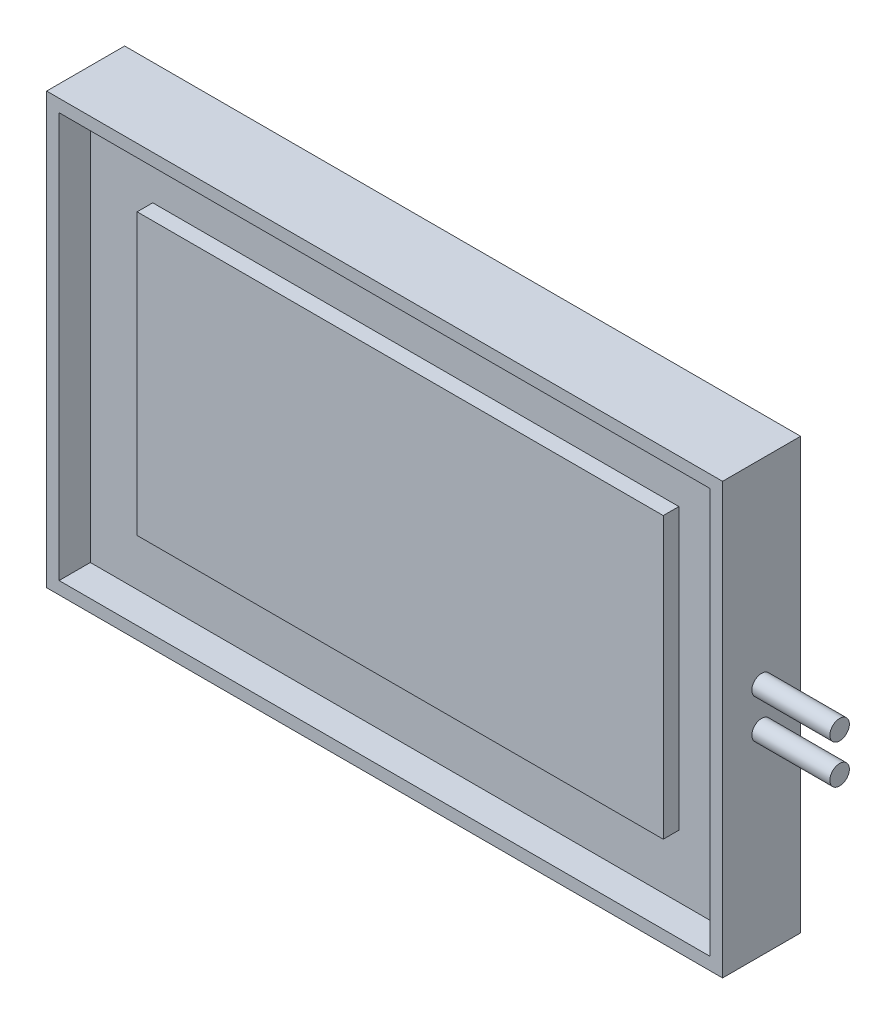
from build123d import *

# Parameters (mm, degrees)
SKETCH1_W           = 55
SKETCH1_H           = 35
BOSS_EXTRUDE1_DEPTH = 6.35
SKETCH2_R           = 0.79375
BOSS_EXTRUDE2_DEPTH = 6.35
SKETCH4_R           = 1.587499993
CUT_EXTRUDE2_DEPTH  = 0.254
SKETCH5_W           = 52.968
SKETCH5_H           = 32.968
CUT_EXTRUDE3_DEPTH  = 2.54
SKETCH6_W           = 42.808
SKETCH6_H           = 22.808
BOSS_EXTRUDE3_DEPTH = 1.27


with BuildPart() as part:
    # Sketch1 → Boss-Extrude1 (new body)
    with BuildSketch(Plane.XY):
        with Locations((-56.246376812, 16.09057971)):
            Rectangle(SKETCH1_W, SKETCH1_H)
    extrude(amount=BOSS_EXTRUDE1_DEPTH)

    # Sketch2 → Boss-Extrude2 (add)
    with BuildSketch(Plane(origin=(-28.746376812, 0, 0), x_dir=(0, 0, -1), z_dir=(1, 0, 0))):
        with Locations(Location((-3.175, 17.67807971, 0), (0, 0, 270))):
            Circle(SKETCH2_R)
        with Locations(Location((-3.175, 14.50307971, 0), (0, 0, 270))):
            Circle(SKETCH2_R)
    extrude(amount=BOSS_EXTRUDE2_DEPTH)

    # Sketch4 → Cut-Extrude2 (cut)
    with BuildSketch(Plane(origin=(0, 0, 0), x_dir=(-1, 0, 0), z_dir=(0, 0, -1))):
        with Locations((56.246376812, 16.09057971)):
            Circle(SKETCH4_R)
    extrude(amount=-CUT_EXTRUDE2_DEPTH, mode=Mode.SUBTRACT)

    # Sketch5 → Cut-Extrude3 (cut)
    with BuildSketch(Plane.XY.offset(6.35)):
        with Locations((-56.246376812, 16.09057971)):
            Rectangle(SKETCH5_W, SKETCH5_H)
    extrude(amount=-CUT_EXTRUDE3_DEPTH, mode=Mode.SUBTRACT)

    # Sketch6 → Boss-Extrude3 (add)
    with BuildSketch(Plane.XY.offset(3.81)):
        with Locations((-56.246376812, 16.09057971)):
            Rectangle(SKETCH6_W, SKETCH6_H)
    extrude(amount=BOSS_EXTRUDE3_DEPTH)


solid = part.part
